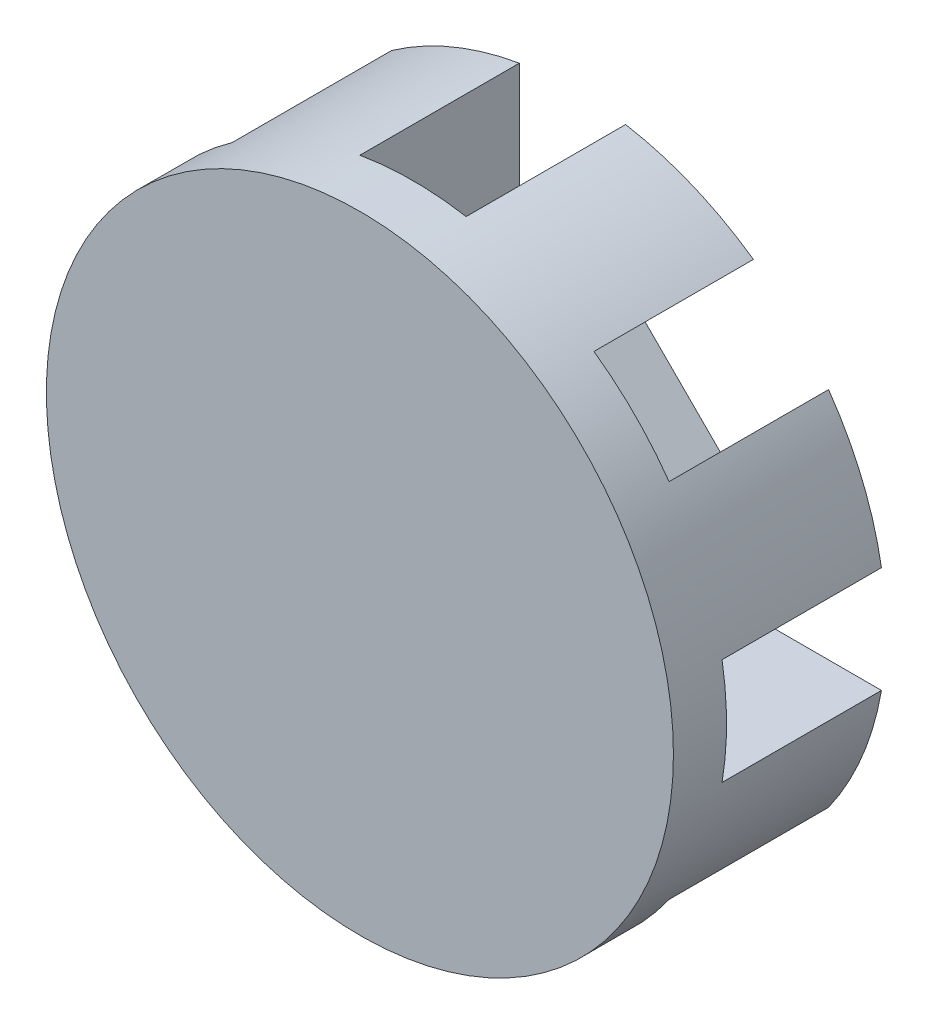
from build123d import *

# Parameters (mm, degrees)
SKETCH1_R           = 5.9
BOSS_EXTRUDE1_DEPTH = 4
CUT_EXTRUDE2_DEPTH  = 3
CIRPATTERN1_COUNT   = 8


with BuildPart() as part:
    # Sketch1 → Boss-Extrude1 (new body)
    with BuildSketch(Plane.XY):
        Circle(SKETCH1_R)
    extrude(amount=BOSS_EXTRUDE1_DEPTH)

    # Sketch2 → Cut-Extrude2 (cut)
    with BuildSketch(Plane(origin=(0, 0, 0), x_dir=(-1, 0, 0), z_dir=(0, 0, -1))):
        with BuildLine():
            Line((1, 5.814636704), (1, 2.93428015))
            Line((1, 2.93428015), (-1, 2.93428015))
            Line((-1, 2.93428015), (-1, 5.814636704))
            ThreePointArc((-1, 5.814636704), (0, 5.9), (1, 5.814636704))
        make_face()
    cut_extrude2 = extrude(amount=-CUT_EXTRUDE2_DEPTH, mode=Mode.SUBTRACT)

    # CirPattern1: Cut-Extrude2 ×8 about axis
    cirpattern1_axis = Axis((0, 0, 0), (0, 0, 1))
    for i in range(1, CIRPATTERN1_COUNT):
        add(cut_extrude2.rotate(cirpattern1_axis, i * 360 / CIRPATTERN1_COUNT), mode=Mode.SUBTRACT)


solid = part.part
